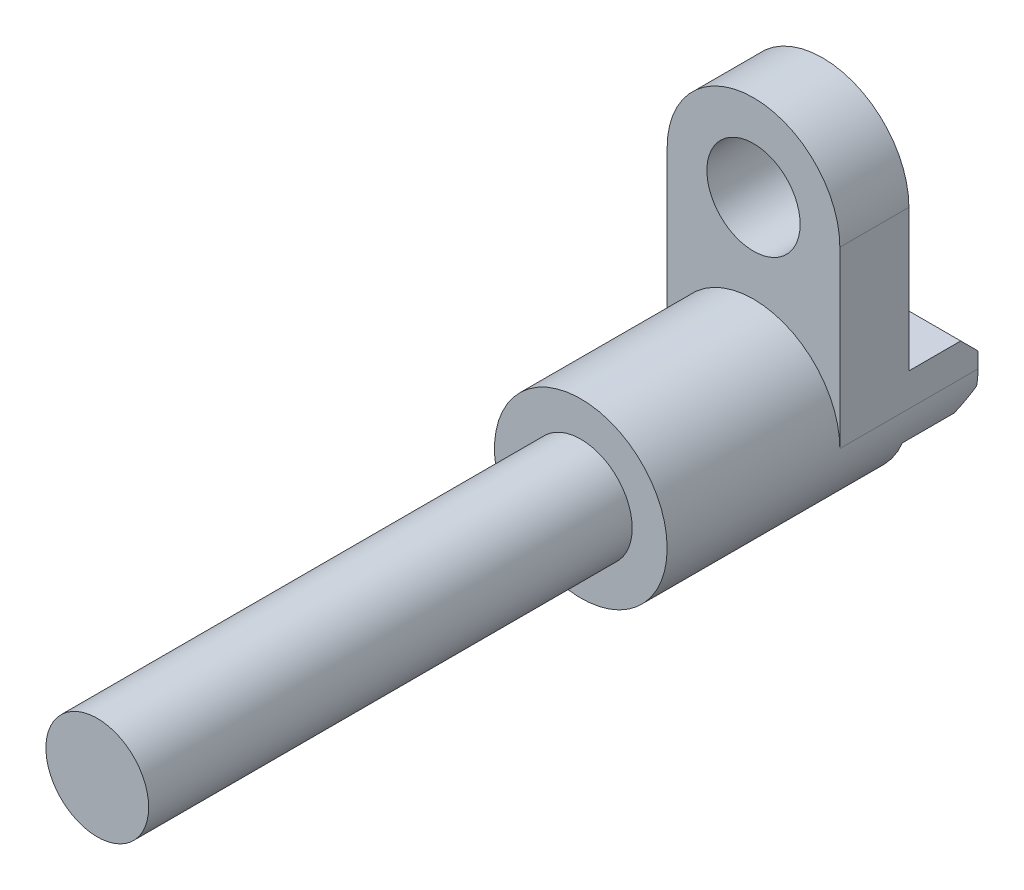
from build123d import *

# Parameters (mm, degrees)
SKETCH1_R           = 1.35
BOSS_EXTRUDE1_DEPTH = 2
SKETCH2_R           = 2.5
BOSS_EXTRUDE2_DEPTH = 5
SKETCH3_R           = 1.4875
BOSS_EXTRUDE3_DEPTH = 14
BOSS_EXTRUDE4_START = 2
BOSS_EXTRUDE4_DEPTH = 2
CHAMFER1_SIZE       = 0.5


with BuildPart() as part:
    # Sketch1 → Boss-Extrude1 (new body)
    with BuildSketch(Plane.XY):
        with BuildLine():
            Line((-2.5, 5.05), (-2.5, 0))
            ThreePointArc((-2.5, 0), (0, -2.5), (2.5, 0))
            Line((2.5, 0), (2.5, 5.05))
            ThreePointArc((2.5, 5.05), (0, 7.55), (-2.5, 5.05))
        make_face()
        with Locations((0, 5.05)):
            Circle(SKETCH1_R, mode=Mode.SUBTRACT)
    extrude(amount=BOSS_EXTRUDE1_DEPTH)

    # Sketch2 → Boss-Extrude2 (add)
    with BuildSketch(Plane.XY.offset(2)):
        Circle(SKETCH2_R)
    extrude(amount=BOSS_EXTRUDE2_DEPTH)

    # Sketch3 → Boss-Extrude3 (add)
    with BuildSketch(Plane.XY.offset(7)):
        Circle(SKETCH3_R)
    extrude(amount=BOSS_EXTRUDE3_DEPTH)

    # Sketch4 → Boss-Extrude4 (add)
    with BuildSketch(Plane(origin=(0, 0, 0), x_dir=(-1, 0, 0), z_dir=(0, 0, -1)).offset(BOSS_EXTRUDE4_START)):
        with BuildLine():
            Line((-2.5, 0), (-2.5, 0.95))
            Line((-2.5, 0.95), (2.5, 0.95))
            Line((2.5, 0.95), (2.5, 0))
            ThreePointArc((2.5, 0), (2.4526685, -0.484166531), (2.312466216, -0.95))
            Line((2.312466216, -0.95), (-2.312466216, -0.95))
            ThreePointArc((-2.312466216, -0.95), (-2.4526685, -0.484166531), (-2.5, 0))
        make_face()
    extrude(amount=-BOSS_EXTRUDE4_DEPTH)

    # Chamfer1
    chamfer1_edges = [part.edges().sort_by_distance(p)[0] for p in [
        (0, -0.95, -2),
        (0, 0.95, -2),
    ]]
    chamfer(chamfer1_edges, length=CHAMFER1_SIZE)


solid = part.part
